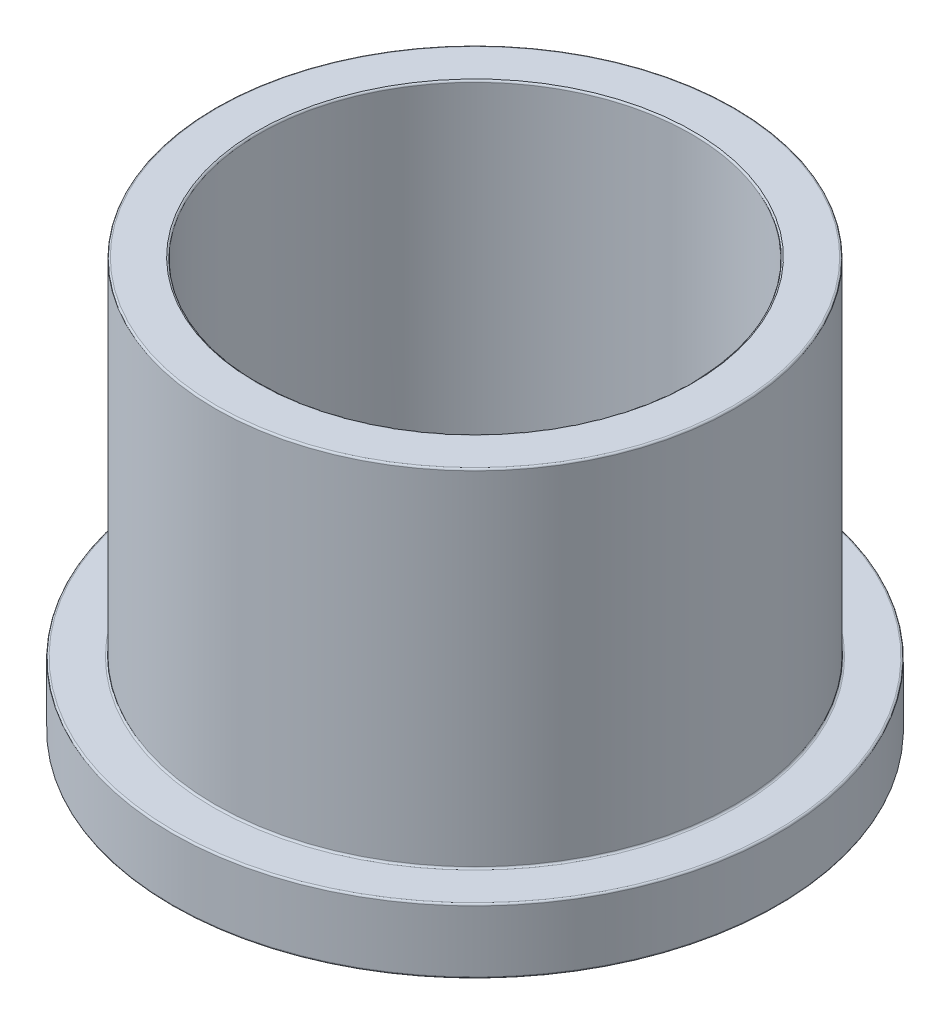
from build123d import *

# Parameters (mm, degrees)
FILLET1_R = 0.127


with BuildPart() as part:
    # Sketch1 → Revolve1 (revolve)
    with BuildSketch(Plane.XY, mode=Mode.PRIVATE) as revolve1_sk:
        Polygon((15.875, 0), (15.875, 30.1625), (19.05, 30.1625), (19.05, 4.7625), (22.225, 4.7625), (22.225, 0), align=None)
    revolve(revolve1_sk.sketch.rotate(Axis((0, 0, 0), (0, 1, 0)), 90), axis=Axis((0, 0, 0), (0, 1, 0)))

    # Fillet1
    fillet1_edges = [part.edges().sort_by_distance(p)[0] for p in [
        (0, 0, 22.225),
        (0, 4.7625, 22.225),
        (0, 4.7625, 19.05),
        (0, 30.1625, 19.05),
        (0, 30.1625, 15.875),
        (0, 0, 15.875),
    ]]
    fillet(fillet1_edges, radius=FILLET1_R)


solid = part.part
